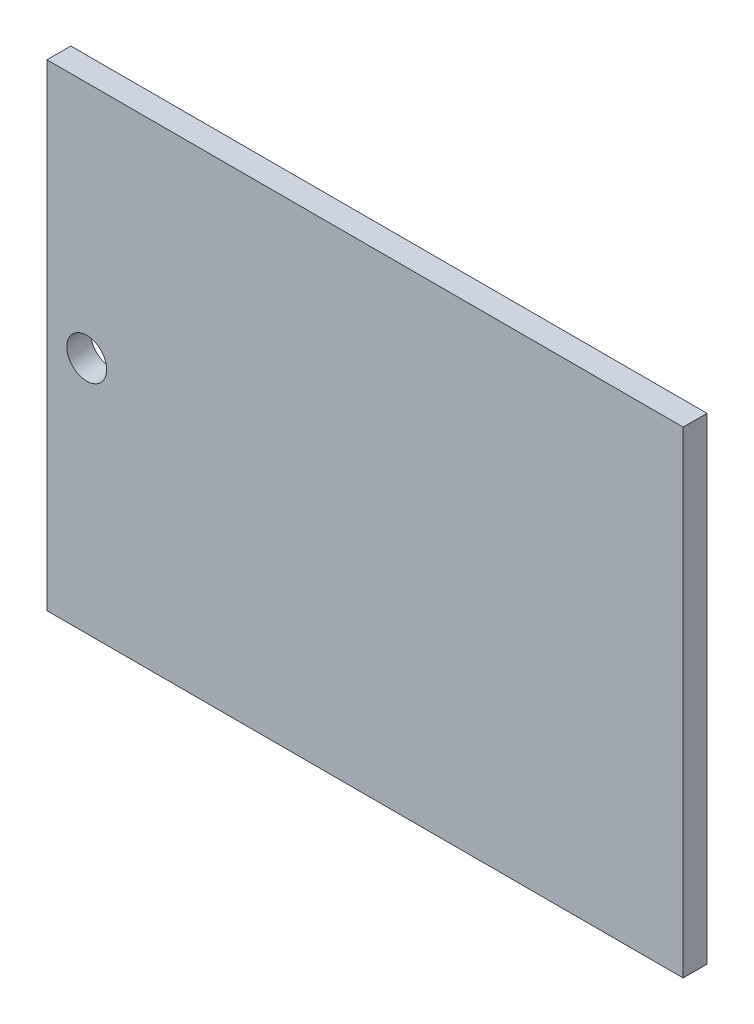
from build123d import *

# Parameters (mm, degrees)
SKETCH1_W           = 40
SKETCH1_H           = 30
BOSS_EXTRUDE2_DEPTH = 1.5
SKETCH2_R           = 1.25
CUT_EXTRUDE1_DEPTH  = 26.044959573


with BuildPart() as part:
    # Sketch1 → Boss-Extrude2 (new body)
    with BuildSketch(Plane.XY):
        Rectangle(SKETCH1_W, SKETCH1_H)
    extrude(amount=BOSS_EXTRUDE2_DEPTH)

    # Sketch2 → Cut-Extrude1 (cut, through all)
    with BuildSketch(Plane.XY.offset(1.5)):
        with Locations((-17.5, 0)):
            Circle(SKETCH2_R)
    extrude(amount=-CUT_EXTRUDE1_DEPTH, mode=Mode.SUBTRACT)


solid = part.part
